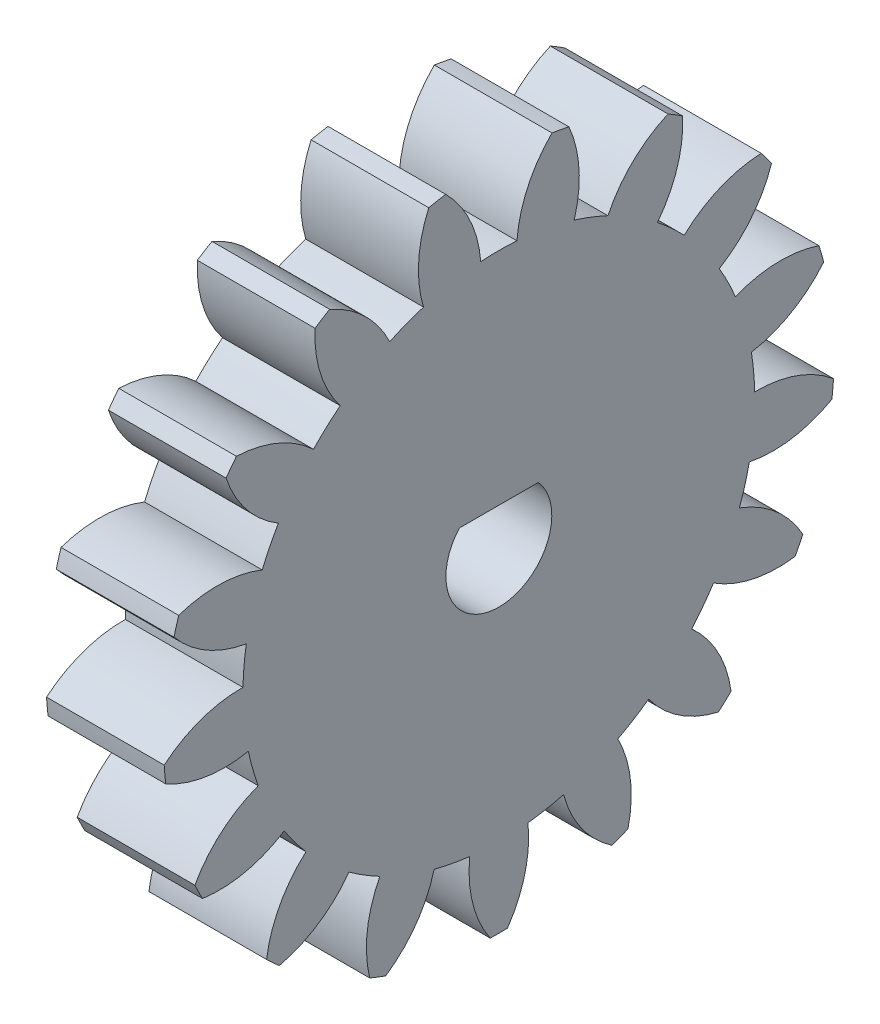
from build123d import *

# Parameters (mm, degrees)
BASPROSKE_W        = 5
BASPROSKE_H        = 14.25
TOOTHCUT_DEPTH     = 21.763549793
TEETHCUTS_COUNT    = 17
TEETHCUTS_ANGLE    = 338.823529412
BORSKE_R           = 0.4
BORE_DEPTH         = 50.0000508
CUT_EXTRUDE1_DEPTH = 21.741790351


with BuildPart() as part:
    # BasProSke → Base-Revolve (revolve)
    with BuildSketch(Plane(origin=(0, 0, 0), x_dir=(1, 0, 0), z_dir=(0, 1, 0)), mode=Mode.PRIVATE) as base_revolve_sk:
        with Locations((2.5, 7.125)):
            Rectangle(BASPROSKE_W, BASPROSKE_H)
    revolve(base_revolve_sk.sketch.rotate(Axis((-10, 0, 0), (1, 0, 0)), 180), axis=Axis((-10, 0, 0), (1, 0, 0)))

    # TooCutSke → ToothCut (cut, through all)
    with BuildSketch(Plane(origin=(0, 0, 0), x_dir=(0, 0, -1), z_dir=(1, 0, 0))):
        with BuildLine():
            ThreePointArc((0.769354207, 10.846749287), (0, 10.874), (-0.769354207, 10.846749287))
            ThreePointArc((-0.769354207, 10.846749287), (-1.230849554, 12.606357238), (-2.280560064, 14.092057726))
            ThreePointArc((-2.280560064, 14.092057726), (0, 14.2754), (2.280560064, 14.092057726))
            ThreePointArc((2.280560064, 14.092057726), (1.230849554, 12.606357238), (0.769354207, 10.846749287))
        make_face()
    toothcut = extrude(amount=TOOTHCUT_DEPTH, mode=Mode.SUBTRACT)

    # TeethCuts: ToothCut ×17 about axis
    teethcuts_axis = Axis((-10, 0, 0), (1, 0, 0))
    for i in range(1, TEETHCUTS_COUNT):
        add(toothcut.rotate(teethcuts_axis, i * TEETHCUTS_ANGLE / (TEETHCUTS_COUNT - 1)), mode=Mode.SUBTRACT)

    # BorSke → Bore (cut, symmetric)
    with BuildSketch(Plane(origin=(0, 0, 0), x_dir=(0, 0, -1), z_dir=(1, 0, 0))):
        with Locations(Location((0, 0, 0), (0, 0, 180))):
            Circle(BORSKE_R)
    extrude(amount=BORE_DEPTH, both=True, mode=Mode.SUBTRACT)

    # Sketch1 → Cut-Extrude1 (cut, through all)
    with BuildSketch(Plane(origin=(5, 0, 0), x_dir=(0, 0, -1), z_dir=(1, 0, 0))):
        with BuildLine():
            Line((-1.677050983, 1.5), (1.677050983, 1.5))
            ThreePointArc((1.677050983, 1.5), (0, -2.25), (-1.677050983, 1.5))
        make_face()
    extrude(amount=-CUT_EXTRUDE1_DEPTH, mode=Mode.SUBTRACT)


solid = part.part
